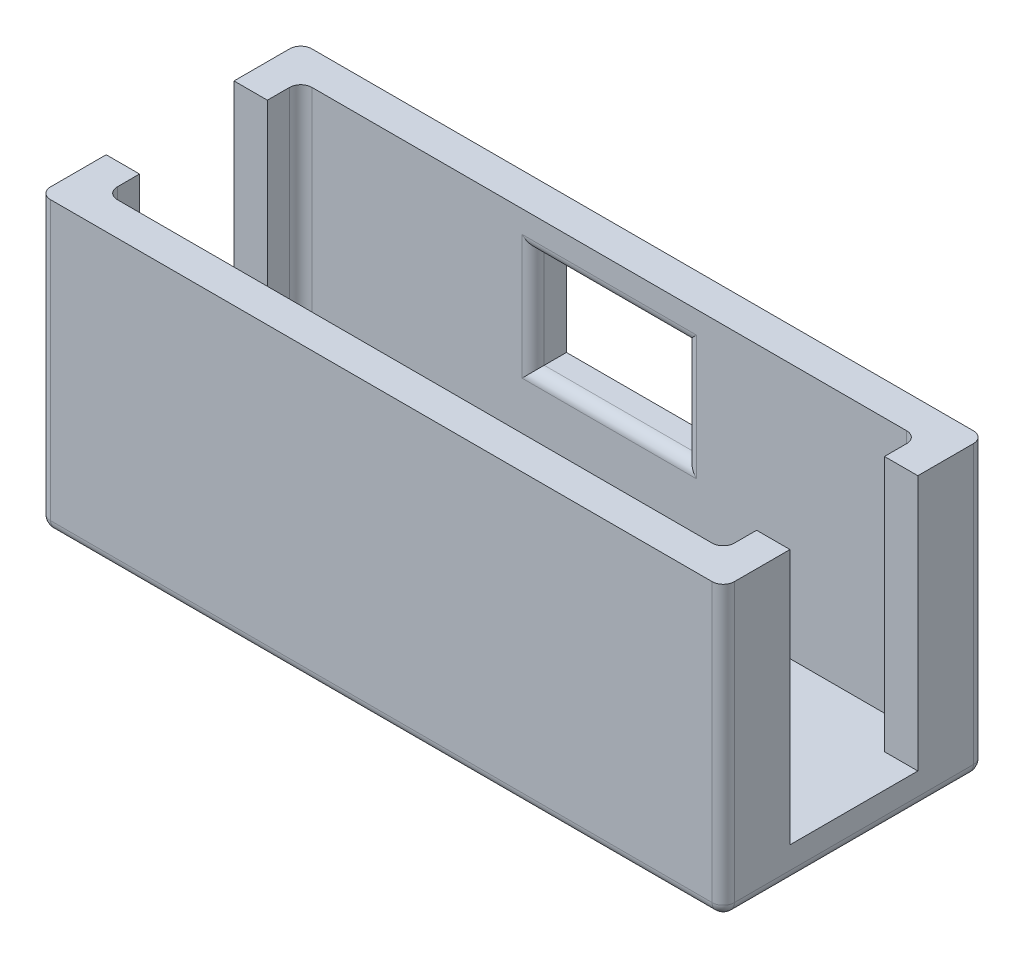
from build123d import *

# Parameters (mm, degrees)
SKETCH1_W           = 61.5
SKETCH1_H           = 23.5
BOSS_EXTRUDE1_DEPTH = 3
BOSS_EXTRUDE2_DEPTH = 23
FILLET1_R           = 1
CUT_EXTRUDE1_REACH  = 48.624
FILLET2_R           = 1


with BuildPart() as part:
    # Sketch1 → Boss-Extrude1 (new body)
    with BuildSketch(Plane(origin=(0, 0, 0), x_dir=(1, 0, 0), z_dir=(0, 1, 0))):
        Rectangle(SKETCH1_W, SKETCH1_H)
    extrude(amount=BOSS_EXTRUDE1_DEPTH)

    # Sketch2 → Boss-Extrude2 (add)
    with BuildSketch(Plane(origin=(0, 3, 0), x_dir=(1, 0, 0), z_dir=(0, 1, 0))):
        Polygon((-27.75, -5.75), (-30.75, -5.75), (-30.75, -11.75), (30.75, -11.75), (30.75, -5.75), (27.75, -5.75), (27.75, -8.75), (-27.75, -8.75), align=None)
        Polygon((30.75, 5.75), (30.75, 11.75), (-30.75, 11.75), (-30.75, 5.75), (-27.75, 5.75), (-27.75, 8.75), (27.75, 8.75), (27.75, 5.75), align=None)
    extrude(amount=BOSS_EXTRUDE2_DEPTH)

    # Fillet1
    fillet1_edges = [part.edges().sort_by_distance(p)[0] for p in [
        (27.75, 14.5, 8.75),
        (-27.75, 14.5, 8.75),
        (-27.75, 14.5, -8.75),
        (27.75, 14.5, -8.75),
        (-30.75, 0, 0),
        (0, 0, 11.75),
        (30.75, 0, 0),
        (0, 0, -11.75),
        (-30.75, 13, -11.75),
        (-30.75, 13, 11.75),
        (30.75, 13, 11.75),
        (30.75, 13, -11.75),
    ]]
    fillet(fillet1_edges, radius=FILLET1_R)

    # Sketch3 → Cut-Extrude1 (cut, up to next)
    with BuildSketch(Plane(origin=(0, 0, -11.75), x_dir=(-1, 0, 0), z_dir=(0, 0, -1)), mode=Mode.PRIVATE) as cut_extrude1_sk1:
        Polygon((6.85, 13.8), (6.85, 23), (0, 23), (-6.85, 23), (-6.85, 13.8), align=None)
    cut_extrude1_tool1 = extrude(cut_extrude1_sk1.sketch, amount=-CUT_EXTRUDE1_REACH, mode=Mode.PRIVATE) & part.part
    add(cut_extrude1_tool1.solids().sort_by_distance((0, 18.4, -11.75))[0], mode=Mode.SUBTRACT)

    # Fillet2
    fillet2_edges = [part.edges().sort_by_distance(p)[0] for p in [
        (0, 23, -8.75),
        (-6.85, 18.4, -8.75),
        (0, 13.8, -8.75),
        (6.85, 18.4, -8.75),
    ]]
    fillet(fillet2_edges, radius=FILLET2_R)


solid = part.part
